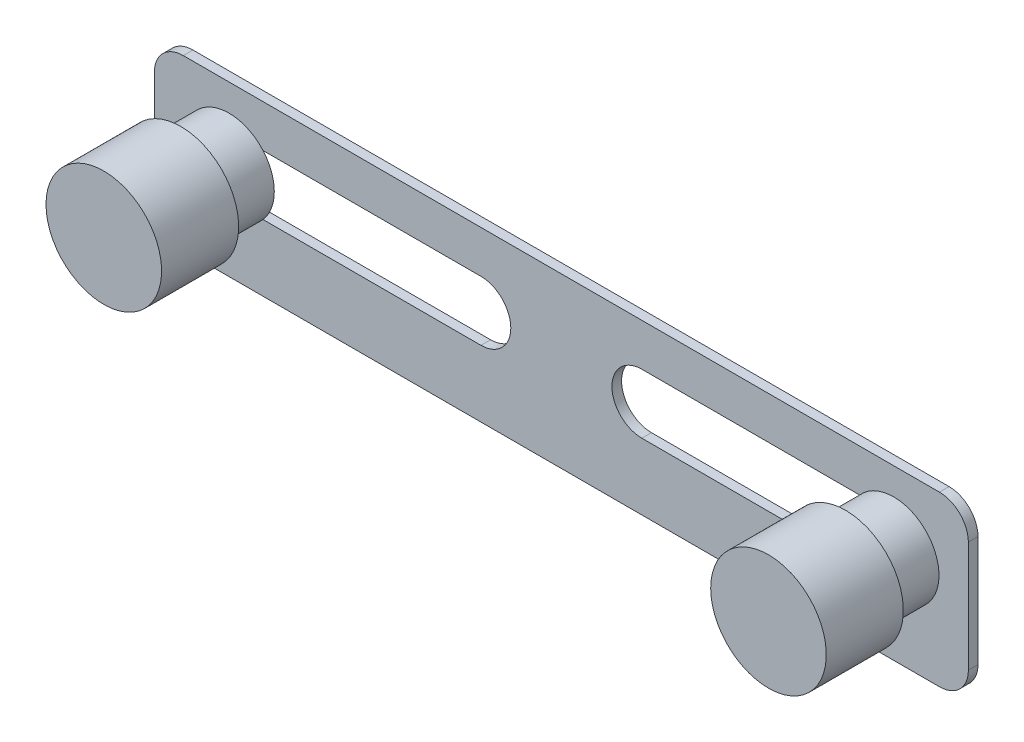
from build123d import *

# Parameters (mm, degrees)
SKETCH1_W           = 84.5
SKETCH1_H           = 17.5
BOSS_EXTRUDE1_DEPTH = 1
FILLET1_R           = 3
SKETCH2_R           = 6
BOSS_EXTRUDE2_DEPTH = 13
SKETCH4_R           = 6
SKETCH4_R_2         = 4.7
CUT_EXTRUDE1_DEPTH  = 5


with BuildPart() as part:
    # Sketch1 → Boss-Extrude1 (new body)
    with BuildSketch(Plane.XY):
        with Locations((42.25, 8.75)):
            Rectangle(SKETCH1_W, SKETCH1_H)
        with BuildLine():
            Line((50.6, 13.1), (77.9, 13.1))
            ThreePointArc((77.9, 13.1), (81, 10), (77.9, 6.9))
            Line((77.9, 6.9), (50.6, 6.9))
            ThreePointArc((50.6, 6.9), (47.5, 10), (50.6, 13.1))
        make_face(mode=Mode.SUBTRACT)
        with BuildLine():
            Line((33.9, 13.1), (6.6, 13.1))
            ThreePointArc((6.6, 13.1), (3.5, 10), (6.6, 6.9))
            Line((6.6, 6.9), (33.9, 6.9))
            ThreePointArc((33.9, 6.9), (37, 10), (33.9, 13.1))
        make_face(mode=Mode.SUBTRACT)
    extrude(amount=BOSS_EXTRUDE1_DEPTH)

    # Fillet1
    fillet1_edges = [part.edges().sort_by_distance(p)[0] for p in [
        (0, 17.5, 0.5),
        (84.5, 17.5, 0.5),
        (84.5, 0, 0.5),
        (0, 0, 0.5),
    ]]
    fillet(fillet1_edges, radius=FILLET1_R)

    # Sketch2 → Boss-Extrude2 (add)
    with BuildSketch(Plane.XY.offset(1)):
        with Locations(Location((7.75, 10, 0), (0, 0, 31.108922511))):
            Circle(SKETCH2_R)
    boss_extrude2 = extrude(amount=BOSS_EXTRUDE2_DEPTH)

    # Sketch4 → Cut-Extrude1 (cut)
    with BuildSketch(Plane.XY.offset(1)):
        with Locations(Location((7.75, 10, 0), (0, 0, 180))):
            Circle(SKETCH4_R)
        with Locations(Location((7.75, 10, 0), (0, 0, 318.732572619))):
            Circle(SKETCH4_R_2, mode=Mode.SUBTRACT)
    cut_extrude1 = extrude(amount=CUT_EXTRUDE1_DEPTH, mode=Mode.SUBTRACT)

    # Mirror1: Boss-Extrude2, Cut-Extrude1 across plane
    add(boss_extrude2.mirror(Plane(origin=(42.25, 0, 0), x_dir=(0, 0, 1), z_dir=(1, 0, 0))))
    add(cut_extrude1.mirror(Plane(origin=(42.25, 0, 0), x_dir=(0, 0, 1), z_dir=(1, 0, 0))), mode=Mode.SUBTRACT)


solid = part.part
